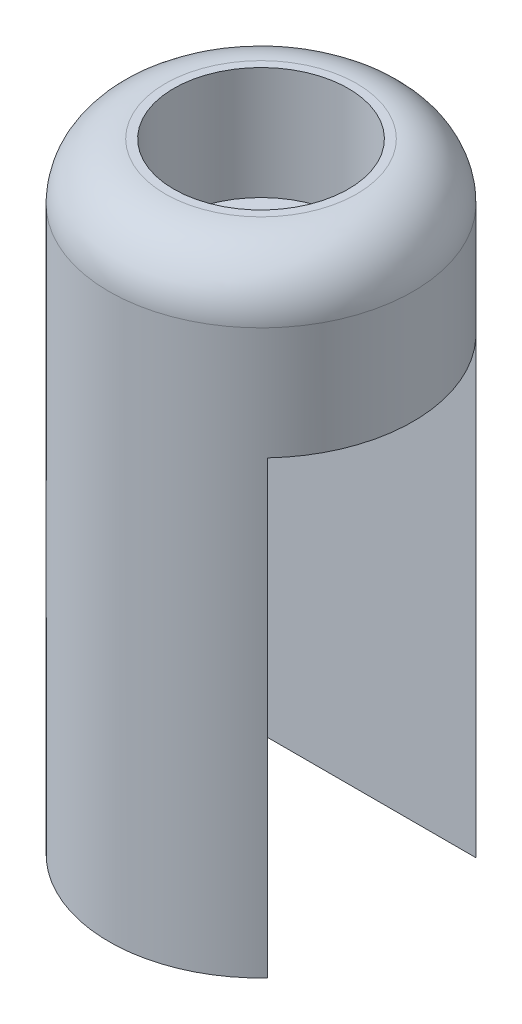
from build123d import *

# Parameters (mm, degrees)
SKETCH1_R           = 2.7
BOSS_EXTRUDE1_DEPTH = 11
CUT_EXTRUDE1_DEPTH  = 8
SKETCH3_R           = 1.55
CUT_EXTRUDE2_DEPTH  = 2
FILLET1_R           = 1


with BuildPart() as part:
    # Sketch1 → Boss-Extrude1 (new body)
    with BuildSketch(Plane(origin=(0, 0, 0), x_dir=(1, 0, 0), z_dir=(0, 1, 0))):
        with Locations(Location((0, 0, 0), (0, 0, 270))):
            Circle(SKETCH1_R)
    extrude(amount=BOSS_EXTRUDE1_DEPTH)

    # Sketch2 → Cut-Extrude1 (cut)
    with BuildSketch(Plane.XZ):
        with BuildLine():
            Line((1.966596044, 1.85), (-1.966596044, 1.85))
            ThreePointArc((-1.966596044, 1.85), (-2.7, 0), (-1.966596044, -1.85))
            Line((-1.966596044, -1.85), (1.966596044, -1.85))
            ThreePointArc((1.966596044, -1.85), (2.7, 0), (1.966596044, 1.85))
        make_face()
    extrude(amount=-CUT_EXTRUDE1_DEPTH, mode=Mode.SUBTRACT)

    # Sketch3 → Cut-Extrude2 (cut)
    with BuildSketch(Plane(origin=(0, 11, 0), x_dir=(1, 0, 0), z_dir=(0, 1, 0))):
        with Locations(Location((0, 0, 0), (0, 0, 270))):
            Circle(SKETCH3_R)
    extrude(amount=-CUT_EXTRUDE2_DEPTH, mode=Mode.SUBTRACT)

    # Fillet1
    fillet1_edges = [part.edges().sort_by_distance(p)[0] for p in [
        (0, 11, -2.7),
    ]]
    fillet(fillet1_edges, radius=FILLET1_R)


solid = part.part
